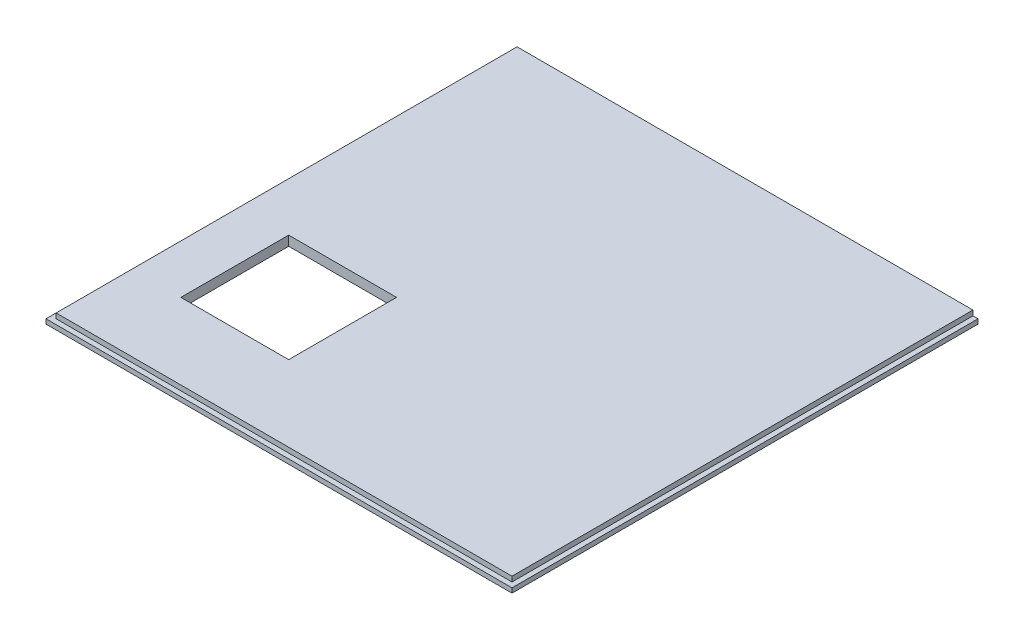
from build123d import *

# Parameters (mm, degrees)
SKETCH1_W           = 877.8875
SKETCH1_H           = 877.8875
SKETCH1_W_2         = 203.2
SKETCH1_H_2         = 203.2
BOSS_EXTRUDE1_DEPTH = 18.25625
CUT_EXTRUDE1_DEPTH  = 9.525


with BuildPart() as part:
    # Sketch1 → Boss-Extrude1 (new body)
    with BuildSketch(Plane(origin=(0, 0, 0), x_dir=(1, 0, 0), z_dir=(0, 1, 0))):
        Rectangle(SKETCH1_W, SKETCH1_H)
        with Locations((-235.74375, -184.94375)):
            Rectangle(SKETCH1_W_2, SKETCH1_H_2, mode=Mode.SUBTRACT)
    extrude(amount=BOSS_EXTRUDE1_DEPTH)

    # Sketch3 → Cut-Extrude1 (cut)
    with BuildSketch(Plane(origin=(0, 18.25625, 0), x_dir=(1, 0, 0), z_dir=(0, 1, 0))):
        Polygon((429.41875, 438.94375), (438.94375, 438.94375), (438.94375, -438.94375), (-438.94375, -438.94375), (-438.94375, 438.94375), (-429.41875, 438.94375), (-429.41875, -429.41875), (429.41875, -429.41875), align=None)
    extrude(amount=-CUT_EXTRUDE1_DEPTH, mode=Mode.SUBTRACT)


solid = part.part
